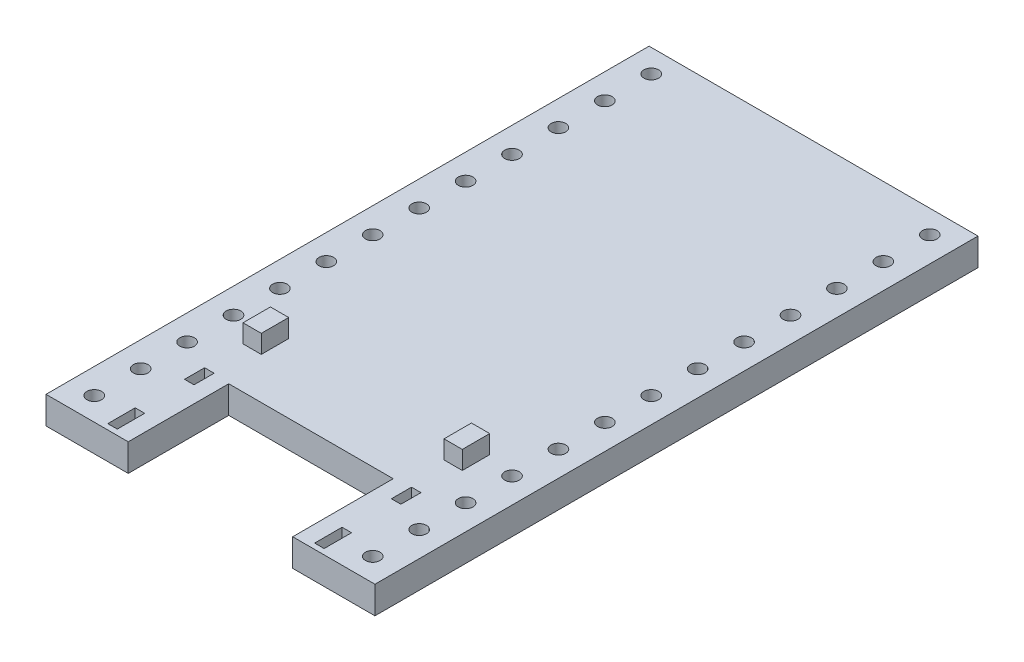
from build123d import *

# Parameters (mm, degrees)
SKETCH1_R           = 0.4
SKETCH1_W           = 0.52
SKETCH1_H           = 1.1
SKETCH1_H_2         = 1.5
BOSS_EXTRUDE1_DEPTH = 1.5
SKETCH2_W           = 1
SKETCH2_H           = 1.5
BOSS_EXTRUDE2_DEPTH = 1


with BuildPart() as part:
    # Sketch1 → Boss-Extrude1 (new body)
    with BuildSketch(Plane(origin=(0, 0, 0), x_dir=(1, 0, 0), z_dir=(0, 1, 0))):
        Polygon((-9, 33), (9, 33), (9, 0), (4.5, 0), (4.5, 5.5), (-4.5, 5.5), (-4.5, 0), (-9, 0), align=None)
        with Locations(Location((7.62, 1.26, 0), (0, 0, 270))):
            Circle(SKETCH1_R, mode=Mode.SUBTRACT)
        with Locations(Location((7.62, 3.8, 0), (0, 0, 270))):
            Circle(SKETCH1_R, mode=Mode.SUBTRACT)
        with Locations(Location((7.62, 6.34, 0), (0, 0, 270))):
            Circle(SKETCH1_R, mode=Mode.SUBTRACT)
        with Locations(Location((7.62, 8.88, 0), (0, 0, 270))):
            Circle(SKETCH1_R, mode=Mode.SUBTRACT)
        with Locations(Location((7.62, 11.42, 0), (0, 0, 270))):
            Circle(SKETCH1_R, mode=Mode.SUBTRACT)
        with Locations(Location((7.62, 13.96, 0), (0, 0, 270))):
            Circle(SKETCH1_R, mode=Mode.SUBTRACT)
        with Locations(Location((7.62, 16.5, 0), (0, 0, 270))):
            Circle(SKETCH1_R, mode=Mode.SUBTRACT)
        with Locations(Location((7.62, 19.04, 0), (0, 0, 270))):
            Circle(SKETCH1_R, mode=Mode.SUBTRACT)
        with Locations(Location((7.62, 21.58, 0), (0, 0, 270))):
            Circle(SKETCH1_R, mode=Mode.SUBTRACT)
        with Locations(Location((7.62, 24.12, 0), (0, 0, 270))):
            Circle(SKETCH1_R, mode=Mode.SUBTRACT)
        with Locations(Location((7.62, 26.66, 0), (0, 0, 270))):
            Circle(SKETCH1_R, mode=Mode.SUBTRACT)
        with Locations(Location((7.62, 29.2, 0), (0, 0, 270))):
            Circle(SKETCH1_R, mode=Mode.SUBTRACT)
        with Locations(Location((7.62, 31.74, 0), (0, 0, 270))):
            Circle(SKETCH1_R, mode=Mode.SUBTRACT)
        with Locations(Location((-7.62, 31.74, 0), (0, 0, 90))):
            Circle(SKETCH1_R, mode=Mode.SUBTRACT)
        with Locations(Location((-7.62, 29.2, 0), (0, 0, 90))):
            Circle(SKETCH1_R, mode=Mode.SUBTRACT)
        with Locations(Location((-7.62, 26.66, 0), (0, 0, 90))):
            Circle(SKETCH1_R, mode=Mode.SUBTRACT)
        with Locations(Location((-7.62, 24.12, 0), (0, 0, 90))):
            Circle(SKETCH1_R, mode=Mode.SUBTRACT)
        with Locations(Location((-7.62, 21.58, 0), (0, 0, 90))):
            Circle(SKETCH1_R, mode=Mode.SUBTRACT)
        with Locations(Location((-7.62, 19.04, 0), (0, 0, 90))):
            Circle(SKETCH1_R, mode=Mode.SUBTRACT)
        with Locations(Location((-7.62, 16.5, 0), (0, 0, 90))):
            Circle(SKETCH1_R, mode=Mode.SUBTRACT)
        with Locations(Location((-7.62, 13.96, 0), (0, 0, 90))):
            Circle(SKETCH1_R, mode=Mode.SUBTRACT)
        with Locations(Location((-7.62, 11.42, 0), (0, 0, 90))):
            Circle(SKETCH1_R, mode=Mode.SUBTRACT)
        with Locations(Location((-7.62, 8.88, 0), (0, 0, 90))):
            Circle(SKETCH1_R, mode=Mode.SUBTRACT)
        with Locations(Location((-7.62, 6.34, 0), (0, 0, 90))):
            Circle(SKETCH1_R, mode=Mode.SUBTRACT)
        with Locations(Location((-7.62, 3.8, 0), (0, 0, 90))):
            Circle(SKETCH1_R, mode=Mode.SUBTRACT)
        with Locations(Location((-7.62, 1.26, 0), (0, 0, 90))):
            Circle(SKETCH1_R, mode=Mode.SUBTRACT)
        with Locations((5.66, 5.05)):
            Rectangle(SKETCH1_W, SKETCH1_H, mode=Mode.SUBTRACT)
        with Locations((5.66, 1.05)):
            Rectangle(SKETCH1_W, SKETCH1_H_2, mode=Mode.SUBTRACT)
        with Locations((-5.66, 1.05)):
            Rectangle(SKETCH1_W, SKETCH1_H_2, mode=Mode.SUBTRACT)
        with Locations((-5.66, 5.05)):
            Rectangle(SKETCH1_W, SKETCH1_H, mode=Mode.SUBTRACT)
    extrude(amount=-BOSS_EXTRUDE1_DEPTH)

    # Sketch2 → Boss-Extrude2 (add)
    with BuildSketch(Plane(origin=(0, 0, 0), x_dir=(1, 0, 0), z_dir=(0, 1, 0))):
        with Locations((-5.5, 8.53)):
            Rectangle(SKETCH2_W, SKETCH2_H)
        with Locations((5.5, 8.53)):
            Rectangle(SKETCH2_W, SKETCH2_H)
    extrude(amount=BOSS_EXTRUDE2_DEPTH)


solid = part.part
